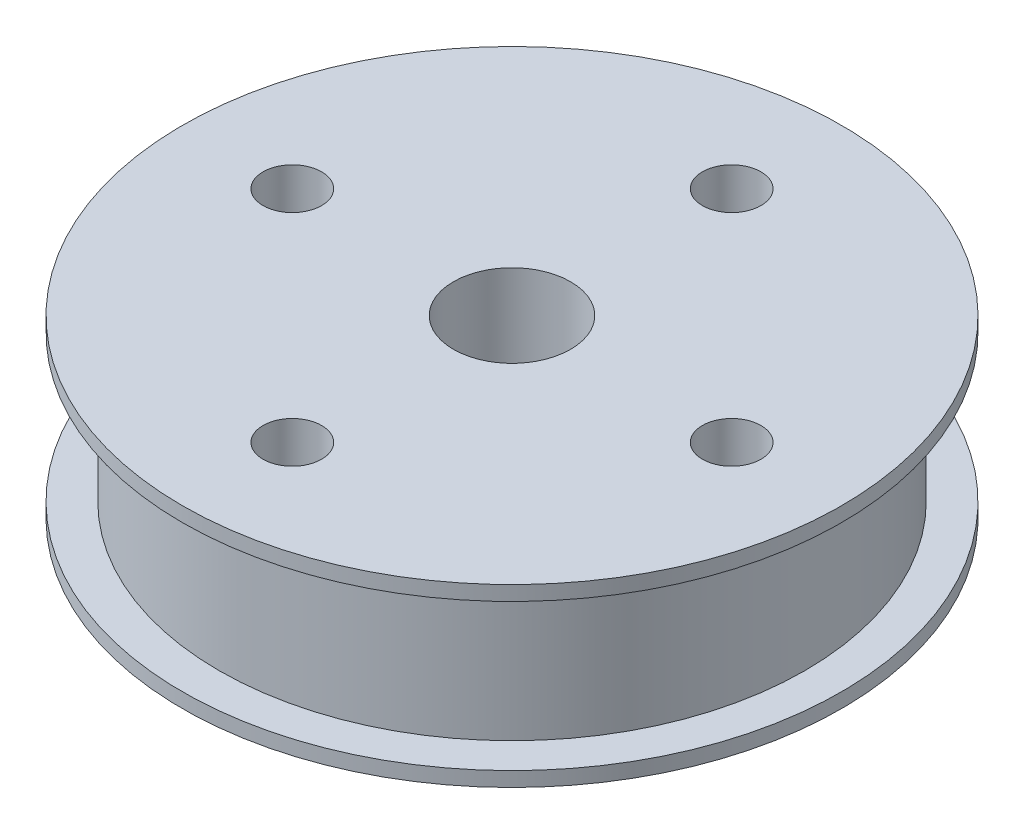
from build123d import *

# Parameters (mm, degrees)
SKETCH_1_R      = 20
SKETCH_1_R_2    = 2
SKETCH_1_R_3    = 4
EXTRUDE_1_DEPTH = 10
SKETCH_2_R      = 22.5
SKETCH_2_R_2    = 4
SKETCH_2_R_3    = 2
EXTRUDE_2_DEPTH = 1
EXTRUDE_START   = 1
SKETCH_3_R      = 22.5
SKETCH_3_R_2    = 4
SKETCH_3_R_3    = 2
EXTRUDE_3_DEPTH = 1


with BuildPart() as part:
    # 草图1 → 凸台-拉伸1 (new body)
    with BuildSketch(Plane(origin=(0, 0, 0), x_dir=(1, 0, 0), z_dir=(0, 1, 0))):
        with Locations(Location((0, 0, 0), (0, 0, 270))):
            Circle(SKETCH_1_R)
        with Locations(Location((0, 15, 0), (0, 0, 270))):
            Circle(SKETCH_1_R_2, mode=Mode.SUBTRACT)
        with Locations(Location((15, 0, 0), (0, 0, 270))):
            Circle(SKETCH_1_R_2, mode=Mode.SUBTRACT)
        with Locations(Location((0, -15, 0), (0, 0, 270))):
            Circle(SKETCH_1_R_2, mode=Mode.SUBTRACT)
        with Locations(Location((-15, 0, 0), (0, 0, 270))):
            Circle(SKETCH_1_R_2, mode=Mode.SUBTRACT)
        with Locations(Location((0, 0, 0), (0, 0, 270))):
            Circle(SKETCH_1_R_3, mode=Mode.SUBTRACT)
    extrude(amount=EXTRUDE_1_DEPTH)

    # 草图2 → 凸台-拉伸2 (add)
    with BuildSketch(Plane(origin=(0, 10, 0), x_dir=(1, 0, 0), z_dir=(0, 1, 0))):
        with Locations(Location((0, 0, 0), (0, 0, 270))):
            Circle(SKETCH_2_R)
        with Locations(Location((0, 0, 0), (0, 0, 270))):
            Circle(SKETCH_2_R_2, mode=Mode.SUBTRACT)
        with Locations(Location((-15, 0, 0), (0, 0, 270))):
            Circle(SKETCH_2_R_3, mode=Mode.SUBTRACT)
        with Locations(Location((0, 15, 0), (0, 0, 270))):
            Circle(SKETCH_2_R_3, mode=Mode.SUBTRACT)
        with Locations(Location((15, 0, 0), (0, 0, 270))):
            Circle(SKETCH_2_R_3, mode=Mode.SUBTRACT)
        with Locations(Location((0, -15, 0), (0, 0, 270))):
            Circle(SKETCH_2_R_3, mode=Mode.SUBTRACT)
    extrude(amount=EXTRUDE_2_DEPTH)

    # 草图3 → 凸台-拉伸3 (add)
    with BuildSketch(Plane.XZ.offset(EXTRUDE_START)):
        with Locations(Location((0, 0, 0), (0, 0, 90))):
            Circle(SKETCH_3_R)
        with Locations(Location((0, 0, 0), (0, 0, 270))):
            Circle(SKETCH_3_R_2, mode=Mode.SUBTRACT)
        with Locations(Location((15, 0, 0), (0, 0, 270))):
            Circle(SKETCH_3_R_3, mode=Mode.SUBTRACT)
        with Locations(Location((0, -15, 0), (0, 0, 270))):
            Circle(SKETCH_3_R_3, mode=Mode.SUBTRACT)
        with Locations(Location((-15, 0, 0), (0, 0, 270))):
            Circle(SKETCH_3_R_3, mode=Mode.SUBTRACT)
        with Locations(Location((0, 15, 0), (0, 0, 270))):
            Circle(SKETCH_3_R_3, mode=Mode.SUBTRACT)
    extrude(amount=-EXTRUDE_3_DEPTH)


solid = part.part
